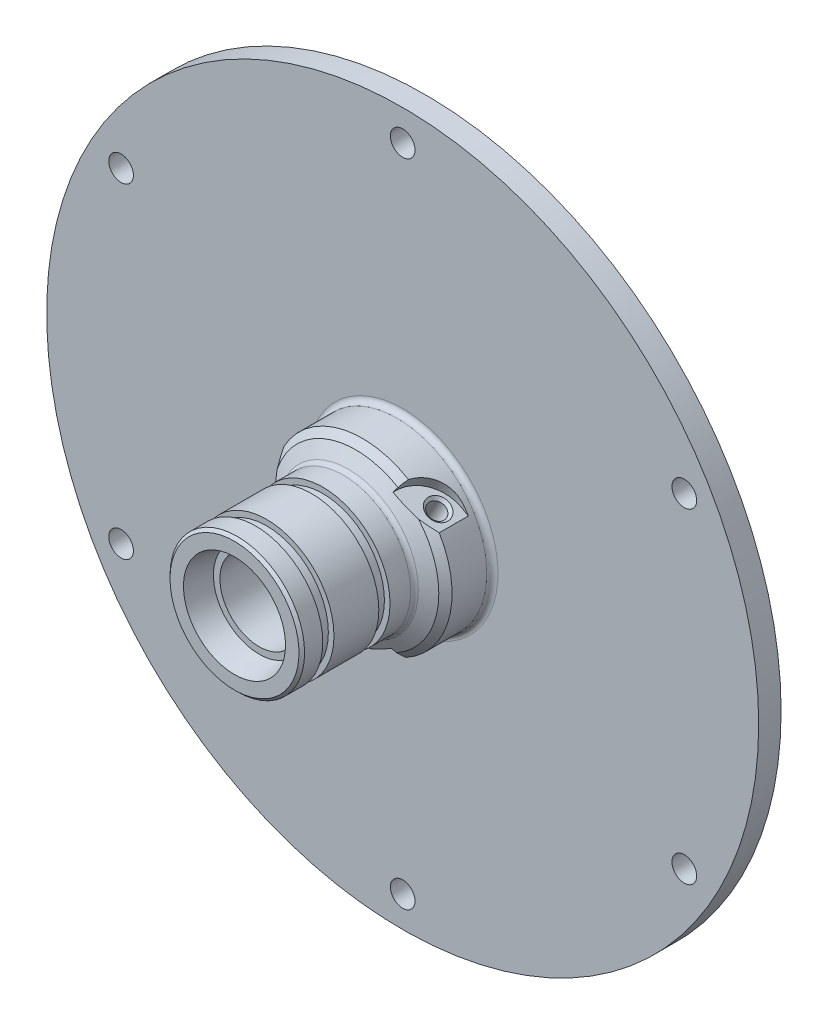
from build123d import *
from OCP.BRepFilletAPI import BRepFilletAPI_MakeChamfer

# Parameters (mm, degrees)
F_6_5_6_5_DIAMETER_HOLE1_D   = 6.5
F_7_0_7_DIAMETER_HOLE1_D     = 7
F_7_0_7_DIAMETER_HOLE1_DEPTH = 9
F_7_0_7_DIAMETER_HOLE1_TIP   = 2.103012167
DRILL_START                  = -7
DRILL_FLAT_DEPTH             = 42.01171732
FUEL_INLET_REACH             = 54.902
FUEL_INLET_END_RADIUS        = 3.25
SKETCH7_R                    = 0.75
INLETS_COUNT                 = 3
SKETCH10_W                   = 1
SKETCH10_H                   = 0.5
TOOL_RAD_R                   = 0.5
EDGE_BREAK_SIZE              = 0.25
EDGE_BREAK_SIZE2             = 0.683012702
F_2_2_2_2_DIAMETER_HOLE1_D   = 2.2
CIRPATTERN1_COUNT            = 6


with BuildPart() as part:
    # Sketch2 → Main Base (revolve)
    with BuildSketch(Plane(origin=(0, 0, 0), x_dir=(0, 0, -1), z_dir=(1, 0, 0)), mode=Mode.PRIVATE) as main_base_sk:
        Polygon((0, 0), (0, 31.75), (-2, 31.75), (-2, 8), (-7, 8), (-7, 6), (-17, 6), (-17, 0), align=None)
    revolve(main_base_sk.sketch.rotate(Axis((0, 0, -29.195597269), (0, 0, -1)), 90), axis=Axis((0, 0, -29.195597269), (0, 0, -1)))

    # Ø6.5 (6.5) Diameter Hole1 (through all)
    with Locations(Plane.XY.offset(17)):
        with Locations((0, 0)):
            Hole(F_6_5_6_5_DIAMETER_HOLE1_D / 2)

    # Ø7.0 (7) Diameter Hole1
    with Locations(Plane.XY.offset(17)):
        with Locations((0, 0)):
            Hole(F_7_0_7_DIAMETER_HOLE1_D / 2, depth=F_7_0_7_DIAMETER_HOLE1_DEPTH)
            with Locations((0, 0, -(F_7_0_7_DIAMETER_HOLE1_DEPTH + F_7_0_7_DIAMETER_HOLE1_TIP / 2))):  # 118° drill point
                Cone(0, F_7_0_7_DIAMETER_HOLE1_D / 2, F_7_0_7_DIAMETER_HOLE1_TIP, mode=Mode.SUBTRACT)

    # Sketch6 → Drill Flat (cut, through all)
    with BuildSketch(Plane(origin=(0, 0, 0), x_dir=(0, 0, -1), z_dir=(1, 0, 0)).offset(DRILL_START)):
        with BuildLine():
            Line((-6.175, 0.075), (-7, 0.075))
            ThreePointArc((-7, 0.075), (-9.24506403, 1.00493597), (-10.175, 3.25))
            Line((-10.175, 3.25), (-10.175, 8))
            Line((-10.175, 8), (-3, 8))
            Line((-3, 8), (-3, 3.25))
            ThreePointArc((-3, 3.25), (-3.92993597, 1.00493597), (-6.175, 0.075))
        make_face()
    drill_flat = extrude(amount=-DRILL_FLAT_DEPTH, mode=Mode.SUBTRACT)

    # Fuel Inlet: up to this cylinder (the profile starts outside it)
    fuel_inlet_end = Plane(origin=(0, 0, 4.5), z_dir=(0, 0, 1)) * Cylinder(FUEL_INLET_END_RADIUS, 117.304, mode=Mode.PRIVATE)
    # Sketch7 → Fuel Inlet (cut, up to the surface)
    with BuildSketch(Plane.ZY.offset(7), mode=Mode.PRIVATE) as fuel_inlet_sk1:
        with Locations((4.5, 2.5)):
            Circle(SKETCH7_R)
    fuel_inlet_tool1 = extrude(fuel_inlet_sk1.sketch, amount=-FUEL_INLET_REACH, mode=Mode.PRIVATE) - fuel_inlet_end
    fuel_inlet = fuel_inlet_tool1.solids().sort_by_distance((-7, 2.5, 4.5))[0]
    add(fuel_inlet, mode=Mode.SUBTRACT)

    # Inlets: Drill Flat, Fuel Inlet ×3 about axis
    inlets_axis = Axis((0, 0, 0), (0, 0, 1))
    add([drill_flat.rotate(inlets_axis, i * 360 / INLETS_COUNT) for i in range(1, INLETS_COUNT)], mode=Mode.SUBTRACT)
    add([fuel_inlet.rotate(inlets_axis, i * 360 / INLETS_COUNT) for i in range(1, INLETS_COUNT)], mode=Mode.SUBTRACT)

    # Sketch8 → Cone Cut (revolve, cut)
    with BuildSketch(Plane(origin=(0, 0, 0), x_dir=(0, 0, -1), z_dir=(1, 0, 0)), mode=Mode.PRIVATE) as cone_cut_sk:
        Polygon((-7, 6), (-5.845299462, 8), (-7, 8), align=None)
    revolve(cone_cut_sk.sketch.rotate(Axis((0, 0, 58.5), (0, 0, -1)), 90), axis=Axis((0, 0, 58.5), (0, 0, -1)), mode=Mode.SUBTRACT)

    # Sketch10 → Radial O-rings (revolve, cut)
    with BuildSketch(Plane(origin=(0, 0, 0), x_dir=(0, 0, -1), z_dir=(1, 0, 0)), mode=Mode.PRIVATE) as radial_o_rings_sk:
        with Locations((-9.628768748, 5.75)):
            Rectangle(SKETCH10_W, SKETCH10_H)
        with Locations((-14.628768748, 5.75)):
            Rectangle(SKETCH10_W, SKETCH10_H)
    revolve(radial_o_rings_sk.sketch.rotate(Axis((0, 0, 58.5), (0, 0, -1)), 90), axis=Axis((0, 0, 58.5), (0, 0, -1)), mode=Mode.SUBTRACT)

    # Sketch11 → ORB Port (revolve, cut)
    with BuildSketch(Plane(origin=(0, 0, 0), x_dir=(0, 0, -1), z_dir=(1, 0, 0)), mode=Mode.PRIVATE) as orb_port_sk:
        Polygon((-17, 4.55), (-14.8, 4.082375564), (-14.8, 3.5), (-17, 3.5), align=None)
    revolve(orb_port_sk.sketch.rotate(Axis((0, 0, 17.730420959), (0, 0, -1)), 90), axis=Axis((0, 0, 17.730420959), (0, 0, -1)), mode=Mode.SUBTRACT)

    # Tool Rad
    tool_rad_edges = [part.edges().sort_by_distance(p)[0] for p in [
        (-6, 0, 7),
        (-8, 0, 2),
    ]]
    fillet(tool_rad_edges, radius=TOOL_RAD_R)

    # Edge Break: one chamfer whose edges measure the first distance from different faces: ONE call of the kernel's chamfer builder (chamfer() names one face for all edges)
    edge_break_edges_1 = [part.edges().sort_by_distance(p)[0] for p in [
        (-6, 0, 17),
        (5.665063509, 4.812177826, 3.75),
        (1.334936491, -7.312177826, 3.75),
        (-7, 2.5, 3.75),
    ]]
    edge_break_edges_2 = [part.edges().sort_by_distance(p)[0] for p in [
        (-5.637822703, -5.675821982, 5.845299462),
        (-2.096494672, 7.720408674, 5.845299462),
        (6.905046679, -4.039842864, 5.845299462),
    ]]
    edge_break_side_2 = [part.faces().sort_by_distance(p)[0] for p in [
        (-8, 0, 4.172649731),
    ]]
    edge_break = BRepFilletAPI_MakeChamfer(part.part.solid().wrapped)
    for e in edge_break_edges_1:
        edge_break.Add(EDGE_BREAK_SIZE, e.wrapped)
    for e in edge_break_edges_2:
        edge_break.Add(EDGE_BREAK_SIZE, EDGE_BREAK_SIZE2, e.wrapped, edge_break_side_2[0].wrapped)  # the first distance lies on this face
    add(Compound.cast(edge_break.Shape()), mode=Mode.REPLACE)

    # Ø2.2 (2.2) Diameter Hole1 (through all)
    with Locations(Plane.XY.offset(2)):
        with Locations((0, 29)):
            f_2_2_2_2_diameter_hole1 = Hole(F_2_2_2_2_DIAMETER_HOLE1_D / 2)

    # CirPattern1: Ø2.2 (2.2) Diameter Hole1 ×6 about axis
    cirpattern1_axis = Axis((0, 0, 0), (0, 0, 1))
    for i in range(1, CIRPATTERN1_COUNT):
        add(f_2_2_2_2_diameter_hole1.rotate(cirpattern1_axis, i * 360 / CIRPATTERN1_COUNT), mode=Mode.SUBTRACT)


solid = part.part
